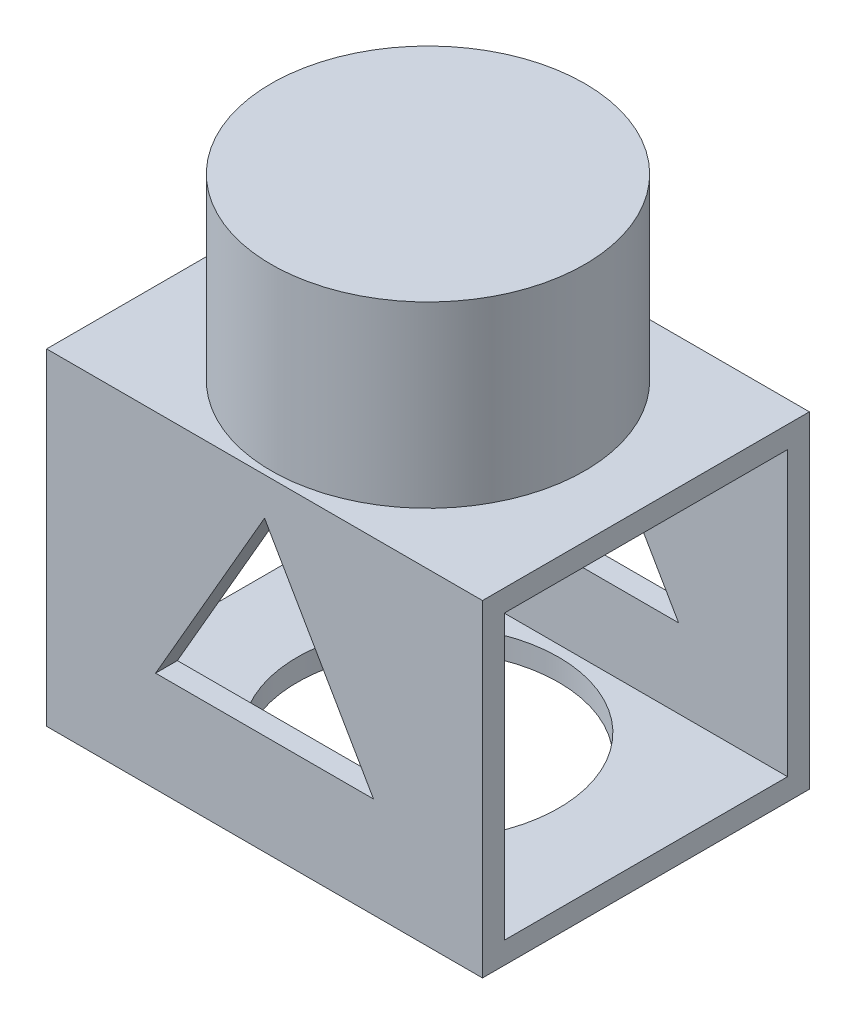
from build123d import *

# Parameters (mm, degrees)
SKETCH1_W           = 200
SKETCH1_H           = 150
BOSS_EXTRUDE1_DEPTH = 150
CUT_EXTRUDE1_DEPTH  = 235.520787991
SKETCH3_W           = 130
SKETCH3_H           = 130
CUT_EXTRUDE2_DEPTH  = 262.007662723
SKETCH4_R           = 60
CUT_EXTRUDE3_DEPTH  = 196.256241898
SKETCH5_R           = 71.933937191
BOSS_EXTRUDE2_DEPTH = 82


with BuildPart() as part:
    # Sketch1 → Boss-Extrude1 (new body)
    with BuildSketch(Plane(origin=(0, 0, 0), x_dir=(1, 0, 0), z_dir=(0, 1, 0))):
        Rectangle(SKETCH1_W, SKETCH1_H)
    extrude(amount=BOSS_EXTRUDE1_DEPTH)

    # Sketch2 → Cut-Extrude1 (cut, through all)
    with BuildSketch(Plane.XY.offset(75)):
        Polygon((0, 132.735026919), (-50, 46.132486541), (50, 46.132486541), align=None)
    extrude(amount=-CUT_EXTRUDE1_DEPTH, mode=Mode.SUBTRACT)

    # Sketch3 → Cut-Extrude2 (cut, through all)
    with BuildSketch(Plane(origin=(100, 0, 0), x_dir=(0, 0, -1), z_dir=(1, 0, 0))):
        with Locations((0, 75)):
            Rectangle(SKETCH3_W, SKETCH3_H)
    extrude(amount=-CUT_EXTRUDE2_DEPTH, mode=Mode.SUBTRACT)

    # Sketch4 → Cut-Extrude3 (cut, through all)
    with BuildSketch(Plane(origin=(0, 150, 0), x_dir=(1, 0, 0), z_dir=(0, 1, 0))):
        with Locations(Location((0, 0, 0), (0, 0, 270))):
            Circle(SKETCH4_R)
    extrude(amount=-CUT_EXTRUDE3_DEPTH, mode=Mode.SUBTRACT)

    # Sketch5 → Boss-Extrude2 (add)
    with BuildSketch(Plane(origin=(0, 150, 0), x_dir=(1, 0, 0), z_dir=(0, 1, 0))):
        with Locations(Location((0, 0, 0), (0, 0, 90))):
            Circle(SKETCH5_R)
    extrude(amount=BOSS_EXTRUDE2_DEPTH)


solid = part.part
